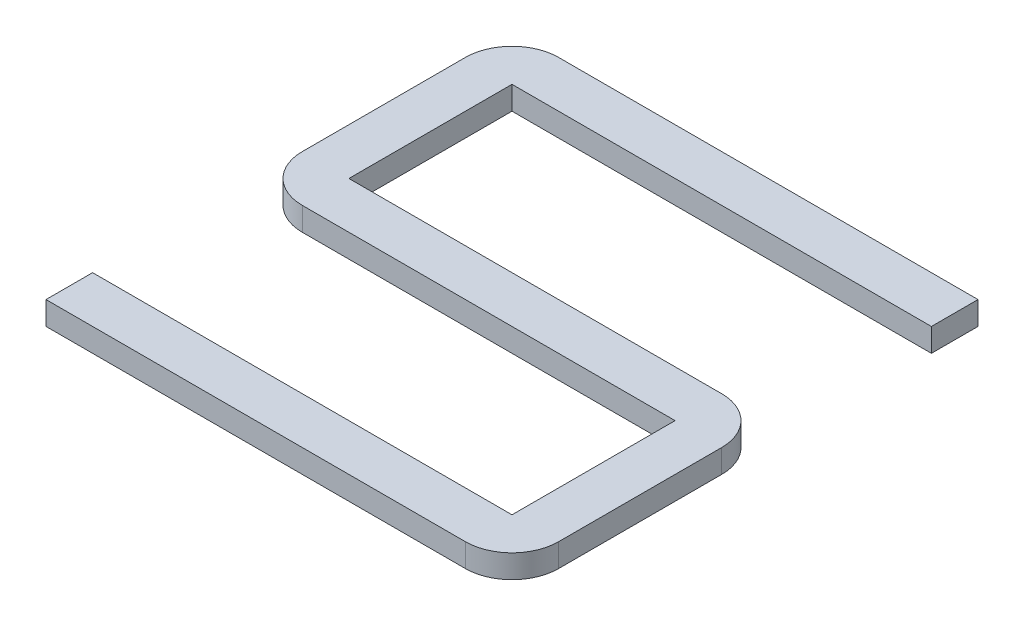
from build123d import *

# Parameters (mm, degrees)
BOSS_EXTRUDE1_DEPTH = 2


with BuildPart() as part:
    # Sketch2 → Boss-Extrude1 (new body)
    with BuildSketch(Plane(origin=(0, 0, 0), x_dir=(1, 0, 0), z_dir=(0, 1, 0))):
        with BuildLine():
            Line((20, 20), (20, 16))
            Line((20, 16), (-16, 16))
            Line((-16, 16), (-16, 2))
            Line((-16, 2), (16, 2))
            ThreePointArc((16, 2), (18.828427125, 0.828427125), (20, -2))
            Line((20, -2), (20, -16))
            ThreePointArc((20, -16), (18.828427125, -18.828427125), (16, -20))
            Line((16, -20), (-20, -20))
            Line((-20, -20), (-20, -16))
            Line((-20, -16), (16, -16))
            Line((16, -16), (16, -2))
            Line((16, -2), (-16, -2))
            ThreePointArc((-16, -2), (-18.828427125, -0.828427125), (-20, 2))
            Line((-20, 2), (-20, 16))
            ThreePointArc((-20, 16), (-18.828427125, 18.828427125), (-16, 20))
            Line((-16, 20), (20, 20))
        make_face()
    extrude(amount=BOSS_EXTRUDE1_DEPTH)


solid = part.part
